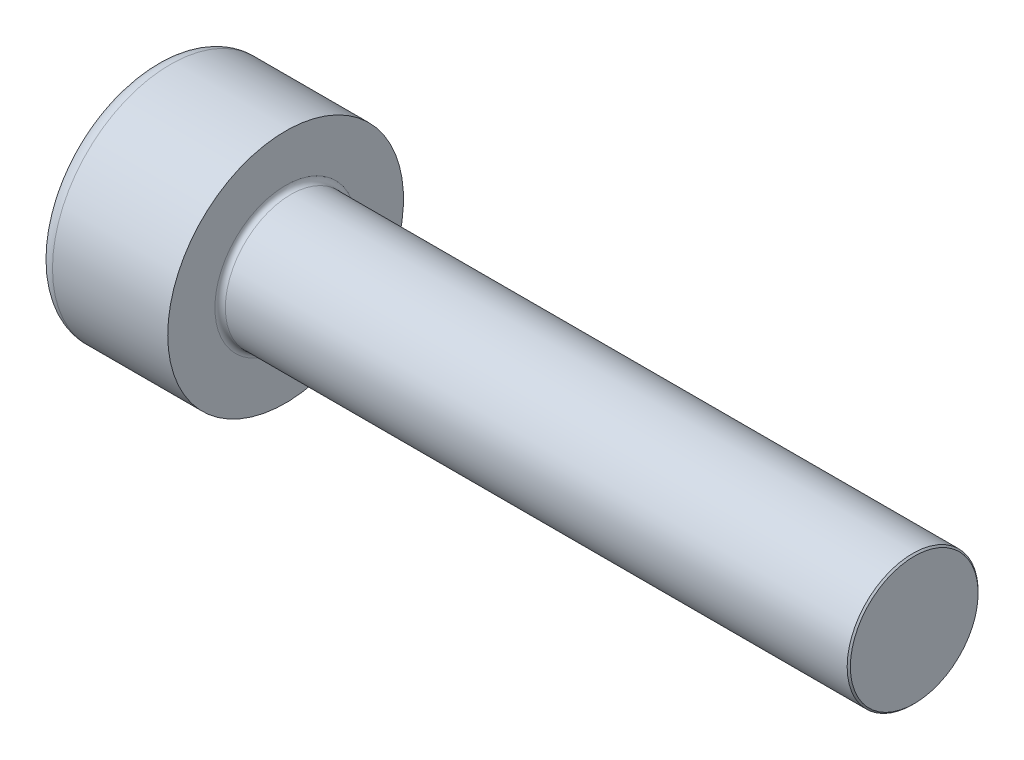
from build123d import *

# Parameters (mm, degrees)
FILLET1_R   = 0.1
FILLET2_R   = 0.3
HEX_2_DEPTH = 1.3


with BuildPart() as part:
    # BodySke → Base-Revolve (revolve)
    with BuildSketch(Plane.XY, mode=Mode.PRIVATE) as base_revolve_sk:
        Polygon((0, 0), (0, 2.25), (2.5, 2.25), (2.5, 1.25), (14.4695, 1.25), (14.5, 1.2195), (14.5, 0), align=None)
    revolve(base_revolve_sk.sketch.rotate(Axis((-31.75, 0, 0), (1, 0, 0)), 90), axis=Axis((-31.75, 0, 0), (1, 0, 0)))

    # Fillet1
    fillet1_edges = [part.edges().sort_by_distance(p)[0] for p in [
        (2.5, 0, -1.25),
    ]]
    fillet(fillet1_edges, radius=FILLET1_R)

    # Fillet2
    fillet2_edges = [part.edges().sort_by_distance(p)[0] for p in [
        (0, 0, -2.25),
    ]]
    fillet(fillet2_edges, radius=FILLET2_R)

    # Sketch2 → Hex-PreBroach (revolve, cut)
    with BuildSketch(Plane.XY, mode=Mode.PRIVATE) as hex_prebroach_sk:
        Polygon((0, 1), (1.3, 1), (1.877350269, 0), (0, 0), align=None)
    revolve(hex_prebroach_sk.sketch.rotate(Axis((0, 0, 0), (1, 0, 0)), 90), axis=Axis((0, 0, 0), (1, 0, 0)), mode=Mode.SUBTRACT)

    # Sketch3 → Hex 2 (cut)
    with BuildSketch(Plane(origin=(0, 0, 0), x_dir=(0, 0.500000000000001, 0.866025403784438), z_dir=(-1, 0, 0))):
        Polygon((0.577350269, 1), (-0.577350269, 1), (-1.154700538, 0), (-0.577350269, -1), (0.577350269, -1), (1.154700538, 0), align=None)
    extrude(amount=-HEX_2_DEPTH, mode=Mode.SUBTRACT)


solid = part.part
